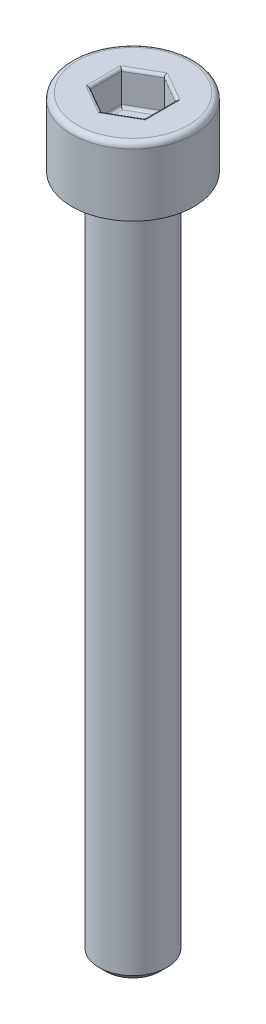
from build123d import *

# Parameters (mm, degrees)
CHAMFER1_SIZE      = 0.25
FILLET1_R          = 0.2
CUT_EXTRUDE1_DEPTH = 1.25
FILLET2_R          = 0.1


with BuildPart() as part:
    # Sketch1 → Revolve1 (revolve)
    with BuildSketch(Plane.XY, mode=Mode.PRIVATE) as revolve1_sk:
        Polygon((0, -27.5), (-1.25, -27.5), (-1.25, -2.5), (-2.25, -2.5), (-2.25, 0), (0, 0), align=None)
    revolve(revolve1_sk.sketch.rotate(Axis((0, 0, 0), (0, -1, 0)), 270), axis=Axis((0, 0, 0), (0, -1, 0)))

    # Chamfer1
    chamfer1_edges = [part.edges().sort_by_distance(p)[0] for p in [
        (0, -2.5, -1.25),
        (0, -27.5, -1.25),
    ]]
    chamfer(chamfer1_edges, length=CHAMFER1_SIZE)

    # Fillet1
    fillet1_edges = [part.edges().sort_by_distance(p)[0] for p in [
        (0, 0, -2.25),
    ]]
    fillet(fillet1_edges, radius=FILLET1_R)

    # Sketch2 → Cut-Extrude1 (cut)
    with BuildSketch(Plane(origin=(0, 0, 0), x_dir=(1, 0, 0), z_dir=(0, 1, 0))):
        Polygon((0, 1.154700538), (-1, 0.577350269), (-1, -0.577350269), (0, -1.154700538), (1, -0.577350269), (1, 0.577350269), align=None)
    extrude(amount=-CUT_EXTRUDE1_DEPTH, mode=Mode.SUBTRACT)

    # Fillet2
    fillet2_edges = [part.edges().sort_by_distance(p)[0] for p in [
        (0.5, -1.25, -0.866025404),
        (1, -1.25, 0),
        (0.5, -1.25, 0.866025404),
        (-0.5, -1.25, 0.866025404),
        (-1, -1.25, 0),
        (-0.5, -1.25, -0.866025404),
        (0.4999999999999987, 0, -0.8660254037844397),
        (-0.5000000000000006, 0, -0.8660254037844395),
        (-1, 0, 0),
        (-0.5000000000000007, 0, 0.8660254037844379),
        (0.4999999999999988, 0, 0.8660254037844382),
        (1, 0, 0),
    ]]
    fillet(fillet2_edges, radius=FILLET2_R)


solid = part.part
